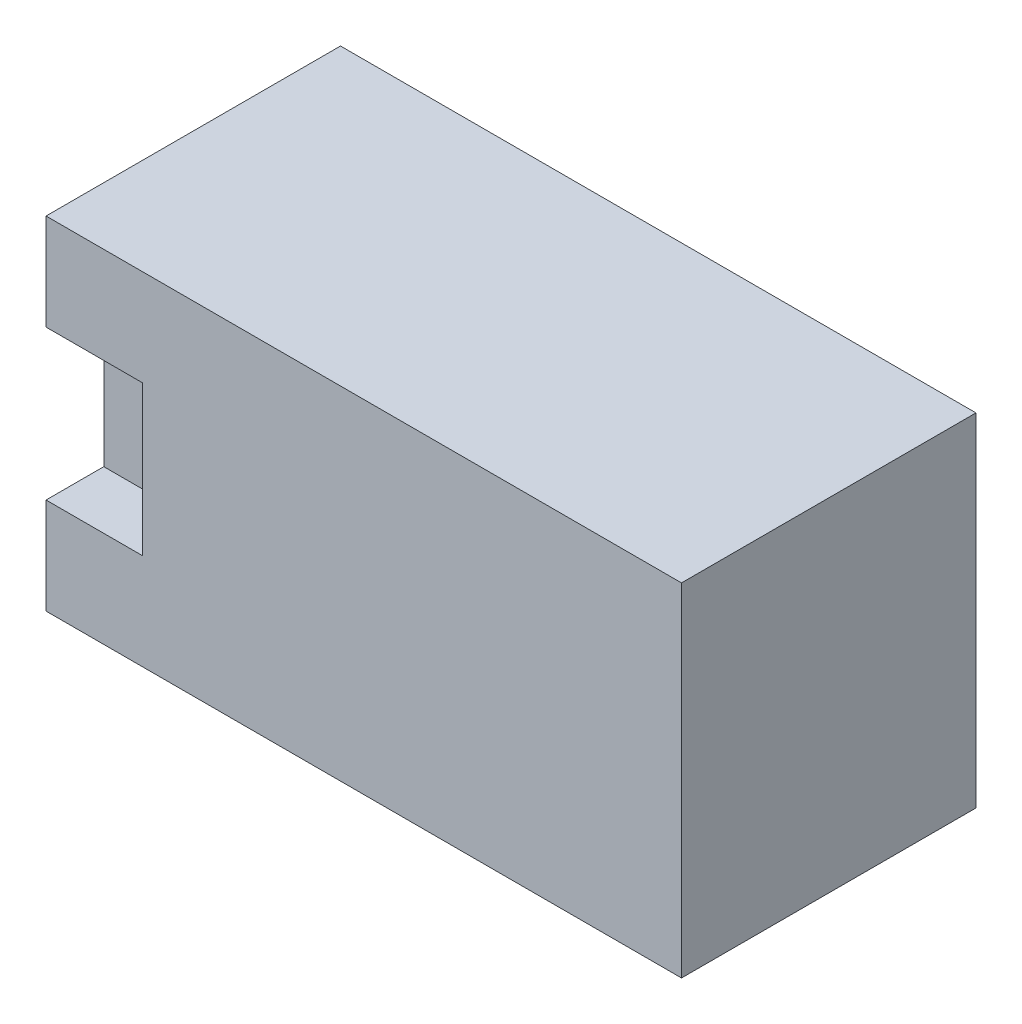
from build123d import *

# Parameters (mm, degrees)
SKETCH1_W           = 33.02
SKETCH1_H           = 17.78
BOSS_EXTRUDE1_DEPTH = 15.3
SKETCH2_W           = 3
SKETCH2_H           = 7.78
CUT_EXTRUDE1_DEPTH  = 5


with BuildPart() as part:
    # Sketch1 → Boss-Extrude1 (new body)
    with BuildSketch(Plane.XY):
        with Locations((-67.418401437, 5.821748731)):
            Rectangle(SKETCH1_W, SKETCH1_H)
    extrude(amount=BOSS_EXTRUDE1_DEPTH)

    # Sketch2 → Cut-Extrude1 (cut)
    with BuildSketch(Plane.ZY.offset(83.928401437)):
        with Locations((13.8, 5.821748731)):
            Rectangle(SKETCH2_W, SKETCH2_H)
    extrude(amount=-CUT_EXTRUDE1_DEPTH, mode=Mode.SUBTRACT)


solid = part.part
